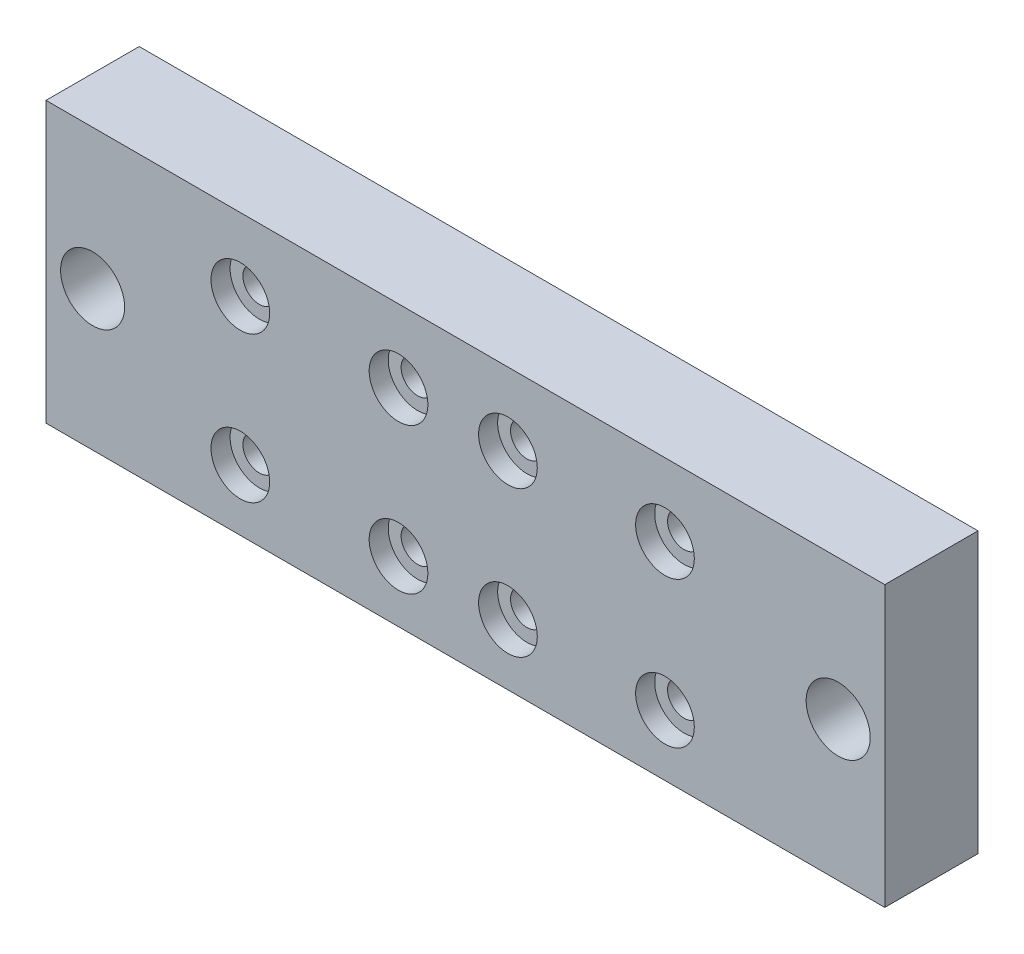
from build123d import *

# Parameters (mm, degrees)
SKETCH1_W                                   = 114.3
SKETCH1_H                                   = 38.1
BOSS_EXTRUDE1_DEPTH                         = 12.7
CBORE_FOR_M4_CHEESE_HEAD_SCREW2_D           = 4.5
CBORE_FOR_M4_CHEESE_HEAD_SCREW2_DEPTH       = 43.18
CBORE_FOR_M4_CHEESE_HEAD_SCREW2_CBORE_D     = 8
CBORE_FOR_M4_CHEESE_HEAD_SCREW2_CBORE_DEPTH = 2.6
CBORE_FOR_M4_CHEESE_HEAD_SCREW2_TIP         = 1.351936393
F_11_32_0_34375_DIAMETER_HOLE1_D            = 8.73125
F_11_32_0_34375_DIAMETER_HOLE1_ON_FACE_2_D  = 8.73125


with BuildPart() as part:
    # Sketch1 → Boss-Extrude1 (new body)
    with BuildSketch(Plane.XY):
        with Locations((57.15, 19.05)):
            Rectangle(SKETCH1_W, SKETCH1_H)
    extrude(amount=BOSS_EXTRUDE1_DEPTH)

    # CBORE for M4 Cheese Head Screw2
    with Locations(Plane(origin=(26.478537206, 28.204773482, 12.7), x_dir=(1, 0, 0), z_dir=(0, 0, 1))):
        with Locations((0, 0), (21.558092234, 0), (36.468605638, 0), (57.867021711, 0), (57.867021711, -19.901433884), (36.468605638, -19.901433884), (21.558092234, -19.901433884), (0, -19.901433884)):
            CounterBoreHole(CBORE_FOR_M4_CHEESE_HEAD_SCREW2_D / 2, CBORE_FOR_M4_CHEESE_HEAD_SCREW2_CBORE_D / 2, CBORE_FOR_M4_CHEESE_HEAD_SCREW2_CBORE_DEPTH, depth=CBORE_FOR_M4_CHEESE_HEAD_SCREW2_DEPTH)
            with Locations((0, 0, -(CBORE_FOR_M4_CHEESE_HEAD_SCREW2_DEPTH + CBORE_FOR_M4_CHEESE_HEAD_SCREW2_TIP / 2))):  # 118° drill point
                Cone(0, CBORE_FOR_M4_CHEESE_HEAD_SCREW2_D / 2, CBORE_FOR_M4_CHEESE_HEAD_SCREW2_TIP, mode=Mode.SUBTRACT)

    # 11/32 (0.34375) Diameter Hole1 (through all)
    with Locations(Plane(origin=(6.35, 19.05, 12.7), x_dir=(1, 0, 0), z_dir=(0, 0, 1))):
        with Locations((0, 0), (101.6, 0)):
            Hole(F_11_32_0_34375_DIAMETER_HOLE1_D / 2)

    # 11/32 (0.34375) Diameter Hole1 on face 2 (through all)
    with Locations(Plane(origin=(46.203135817, 61.386657337, 0), x_dir=(1, 0, 0), z_dir=(0, 0, 1))):
        with Locations((0, 0)):
            Hole(F_11_32_0_34375_DIAMETER_HOLE1_ON_FACE_2_D / 2)


solid = part.part
